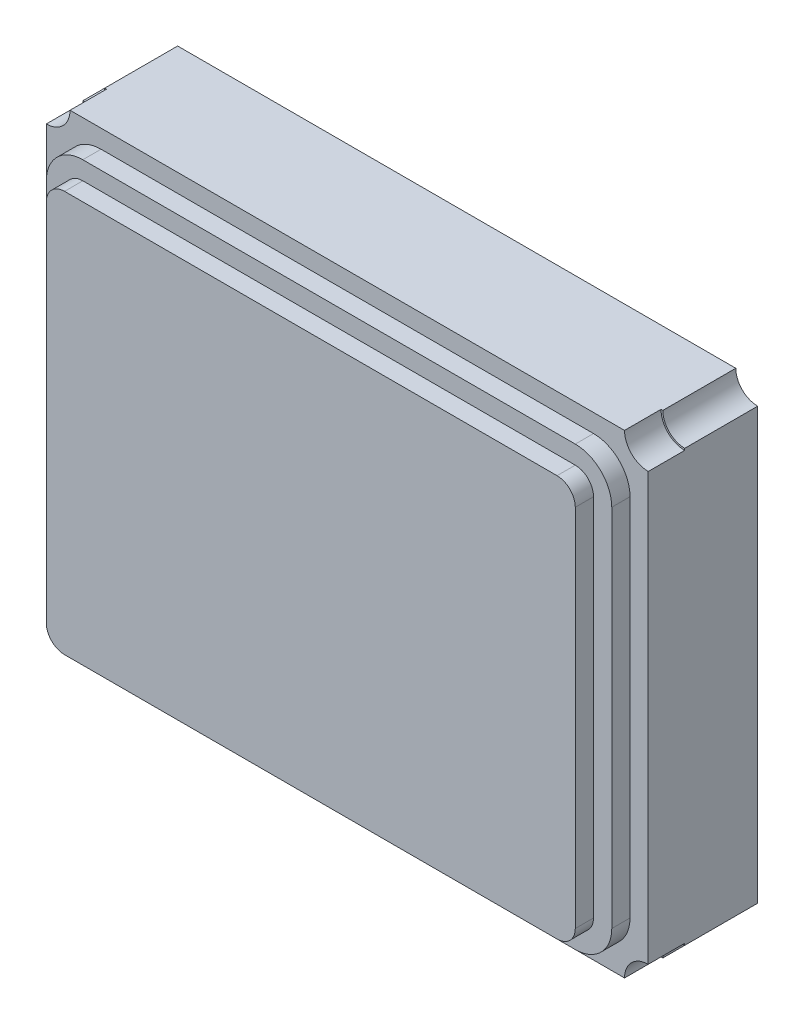
from build123d import *

# Parameters (mm, degrees)
BOSS_EXTRUDE1_DEPTH = 0.8
SKETCH2_OUTSIDE_W   = 6.156
SKETCH2_OUTSIDE_H   = 5.456
CUT_EXTRUDE1_DEPTH  = 0.1
SKETCH4_OUTSIDE_W   = 6.156
SKETCH4_OUTSIDE_H   = 5.456
CUT_EXTRUDE2_DEPTH  = 0.2
CUT_EXTRUDE5_DEPTH  = 0.2


with BuildPart() as part:
    # Sketch1 → Boss-Extrude1 (new body)
    with BuildSketch(Plane.XY):
        with BuildLine():
            ThreePointArc((-1.65, -1.18), (-1.565147186, -1.215147186), (-1.53, -1.3))
            Line((-1.53, -1.3), (1.53, -1.3))
            ThreePointArc((1.53, -1.3), (1.565147186, -1.215147186), (1.65, -1.18))
            Line((1.65, -1.18), (1.65, 1.18))
            ThreePointArc((1.65, 1.18), (1.565147186, 1.215147186), (1.53, 1.3))
            Line((1.53, 1.3), (-1.53, 1.3))
            ThreePointArc((-1.53, 1.3), (-1.565147186, 1.215147186), (-1.65, 1.18))
            Line((-1.65, 1.18), (-1.65, -1.18))
        make_face()
    extrude(amount=BOSS_EXTRUDE1_DEPTH)

    # Sketch2 outside → Cut-Extrude1 (cut)
    with BuildSketch(Plane.XY.offset(0.8)):
        Rectangle(SKETCH2_OUTSIDE_W, SKETCH2_OUTSIDE_H)
        with BuildLine():
            Line((-1.35, -1.1), (1.35, -1.1))
            ThreePointArc((1.35, -1.1), (1.420710678, -1.070710678), (1.45, -1))
            Line((1.45, -1), (1.45, 1))
            ThreePointArc((1.45, 1), (1.420710678, 1.070710678), (1.35, 1.1))
            Line((1.35, 1.1), (-1.35, 1.1))
            ThreePointArc((-1.35, 1.1), (-1.420710678, 1.070710678), (-1.45, 1))
            Line((-1.45, 1), (-1.45, -1))
            ThreePointArc((-1.45, -1), (-1.420710678, -1.070710678), (-1.35, -1.1))
        make_face(mode=Mode.SUBTRACT)
    extrude(amount=-CUT_EXTRUDE1_DEPTH, mode=Mode.SUBTRACT)

    # Sketch4 outside → Cut-Extrude2 (cut)
    with BuildSketch(Plane.XY.offset(0.8)):
        Rectangle(SKETCH4_OUTSIDE_W, SKETCH4_OUTSIDE_H)
        with BuildLine():
            Line((-1.35, -1.2), (1.35, -1.2))
            ThreePointArc((1.35, -1.2), (1.491421356, -1.141421356), (1.55, -1))
            Line((1.55, -1), (1.55, 1))
            ThreePointArc((1.55, 1), (1.491421356, 1.141421356), (1.35, 1.2))
            Line((1.35, 1.2), (-1.35, 1.2))
            ThreePointArc((-1.35, 1.2), (-1.491421356, 1.141421356), (-1.55, 1))
            Line((-1.55, 1), (-1.55, -1))
            ThreePointArc((-1.55, -1), (-1.491421356, -1.141421356), (-1.35, -1.2))
        make_face(mode=Mode.SUBTRACT)
    extrude(amount=-CUT_EXTRUDE2_DEPTH, mode=Mode.SUBTRACT)

    # Sketch5 → Cut-Extrude5 (cut)
    with BuildSketch(Plane.XY.offset(0.6)):
        with BuildLine():
            Line((1.65, -1.17), (1.65, -1.3))
            Line((1.65, -1.3), (1.52, -1.3))
            ThreePointArc((1.52, -1.3), (1.558076118, -1.208076118), (1.65, -1.17))
        make_face()
        with BuildLine():
            Line((-1.65, -1.17), (-1.65, -1.3))
            Line((-1.65, -1.3), (-1.52, -1.3))
            ThreePointArc((-1.52, -1.3), (-1.558076118, -1.208076118), (-1.65, -1.17))
        make_face()
        with BuildLine():
            Line((-1.52, 1.3), (-1.65, 1.3))
            Line((-1.65, 1.3), (-1.65, 1.17))
            ThreePointArc((-1.65, 1.17), (-1.558076118, 1.208076118), (-1.52, 1.3))
        make_face()
        with BuildLine():
            Line((1.52, 1.3), (1.65, 1.3))
            Line((1.65, 1.3), (1.65, 1.17))
            ThreePointArc((1.65, 1.17), (1.558076118, 1.208076118), (1.52, 1.3))
        make_face()
    extrude(amount=-CUT_EXTRUDE5_DEPTH, mode=Mode.SUBTRACT)


solid = part.part
